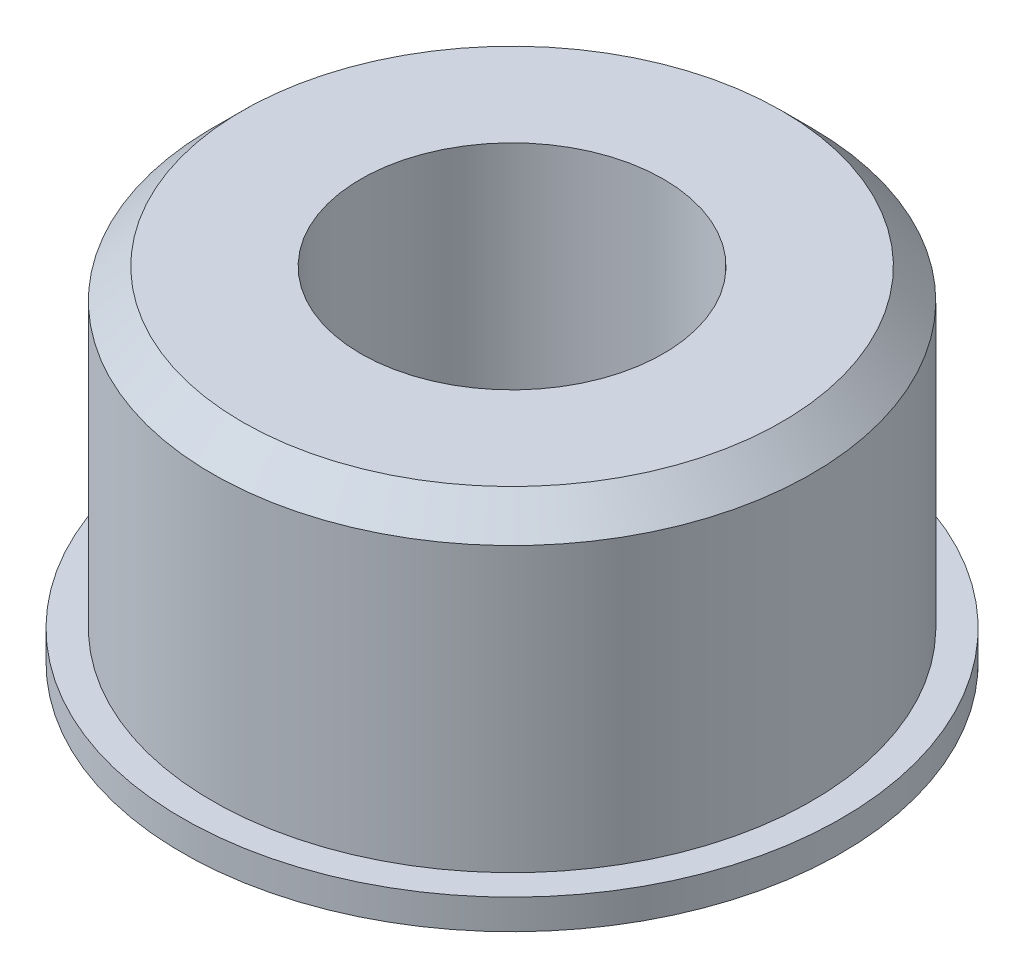
from build123d import *


with BuildPart() as part:
    # Sketch2 → Revolve1 (revolve)
    with BuildSketch(Plane.XY):
        Polygon((-11, 0), (-11, -1), (-8.25, -1), (-8.25, 2.955), (-5.05, 2.955), (-5.05, 10.455), (-9, 10.455), (-10, 9.455), (-10, 0), align=None)
    revolve(axis=Axis((0, 0, 0), (0, 1, 0)))


solid = part.part
